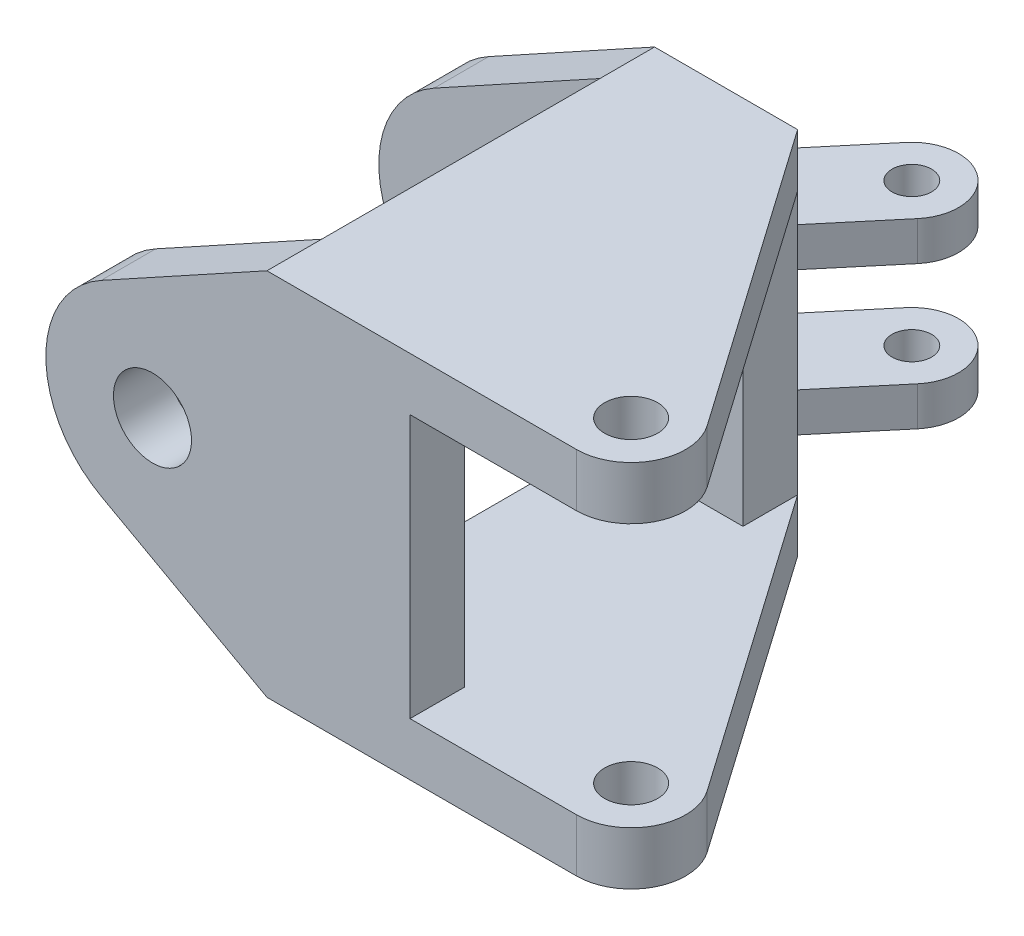
from build123d import *

# Parameters (mm, degrees)
SKETCH1_R           = 75
BOSS_EXTRUDE1_DEPTH = 105
SKETCH3_R           = 51
BOSS_EXTRUDE3_DEPTH = 102
BOSS_EXTRUDE4_START = -105
SKETCH7_R           = 75
BOSS_EXTRUDE4_DEPTH = 105
BOSS_EXTRUDE5_START = -180
SKETCH8_R           = 38
BOSS_EXTRUDE5_DEPTH = 75


with BuildPart() as part:
    # Sketch1 → Boss-Extrude1 (new body)
    with BuildSketch(Plane.XY):
        with BuildLine():
            Line((495, -355), (495, 355))
            Line((495, 355), (220, 355))
            Line((220, 355), (-98.810385884, 179.614887026))
            ThreePointArc((-98.810385884, 179.614887026), (-205, 0), (-98.810385884, -179.614887026))
            Line((-98.810385884, -179.614887026), (220, -355))
            Line((220, -355), (495, -355))
        make_face()
        Circle(SKETCH1_R, mode=Mode.SUBTRACT)
    extrude(amount=-BOSS_EXTRUDE1_DEPTH)

    # Sketch3 → Boss-Extrude3 (add)
    with BuildSketch(Plane(origin=(0, 355, 0), x_dir=(1, 0, 0), z_dir=(0, 1, 0))):
        with BuildLine():
            ThreePointArc((900.990279967, 165.185790909), (908.113739275, 56.502804044), (815, 0))
            Line((815, 0), (495, 0))
            Line((495, 0), (495, 105))
            Line((495, 105), (220, 105))
            Line((220, 105), (220, 745))
            Line((220, 745), (495, 745))
            Line((495, 745), (900.990279967, 165.185790909))
        make_face()
        with Locations(Location((815, 104.974748664, 0), (0, 0, 180))):
            Circle(SKETCH3_R, mode=Mode.SUBTRACT)
    boss_extrude3 = extrude(amount=-BOSS_EXTRUDE3_DEPTH)

    # Mirror1: Boss-Extrude3 across plane
    add(boss_extrude3.mirror(Plane.ZX))

    # Sketch7 → Boss-Extrude4 (add)
    with BuildSketch(Plane(origin=(0, 0, -745), x_dir=(-1, 0, 0), z_dir=(0, 0, -1)).offset(BOSS_EXTRUDE4_START)):
        with BuildLine():
            Line((-220, -253), (-220, -355))
            Line((-220, -355), (98.810385884, -179.614887026))
            ThreePointArc((98.810385884, -179.614887026), (205, 0), (98.810385884, 179.614887026))
            Line((98.810385884, 179.614887026), (-220, 355))
            Line((-220, 355), (-495, 355))
            Line((-495, 355), (-495, -253))
            Line((-495, -253), (-220, -253))
        make_face()
        with Locations(Location((0, 0, 0), (0, 0, 180))):
            Circle(SKETCH7_R, mode=Mode.SUBTRACT)
    extrude(amount=BOSS_EXTRUDE4_DEPTH)

    # Sketch8 → Boss-Extrude5 (add)
    with BuildSketch(Plane(origin=(0, 355, 0), x_dir=(1, 0, 0), z_dir=(0, 1, 0)).offset(BOSS_EXTRUDE5_START)):
        with BuildLine():
            Line((440.558080551, 1007.850884872), (220, 745))
            Line((220, 745), (454.97331208, 745))
            Line((454.97331208, 745), (578.446080312, 892.149115128))
            ThreePointArc((578.446080312, 892.149115128), (567.352965303, 1018.943999881), (440.558080551, 1007.850884872))
        make_face()
        with Locations(Location((509.502080431, 950, 0), (0, 0, 180))):
            Circle(SKETCH8_R, mode=Mode.SUBTRACT)
    boss_extrude5 = extrude(amount=-BOSS_EXTRUDE5_DEPTH)

    # Mirror2: Boss-Extrude5 across plane
    add(boss_extrude5.mirror(Plane.ZX))


solid = part.part
